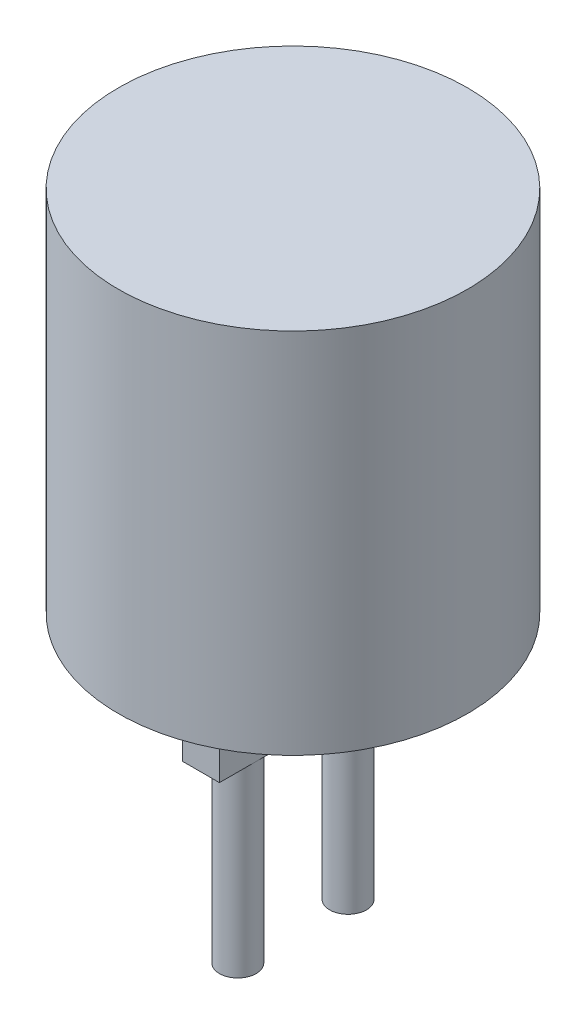
from build123d import *

# Parameters (mm, degrees)
SKETCH_1_W        = 9.5
SKETCH_1_H        = 20
SKETCH_2_R        = 1
EXTRUDE_457_DEPTH = 15
SKETCH_3_W        = 2
SKETCH_3_H        = 10
EXTRUDE_556_DEPTH = 5


with BuildPart() as part:
    # Эскиз1 → Revolve 326 (revolve)
    with BuildSketch(Plane.XY, mode=Mode.PRIVATE) as revolve_326_sk:
        with Locations((4.75, 10)):
            Rectangle(SKETCH_1_W, SKETCH_1_H)
    revolve(revolve_326_sk.sketch.rotate(Axis((0, 0, 0), (0, 1, 0)), 90), axis=Axis((0, 0, 0), (0, 1, 0)))

    # Эскиз2 → Extrude 457 (add)
    with BuildSketch(Plane(origin=(0, 0, 0), x_dir=(1, 0, 0), z_dir=(0, 1, 0))):
        with Locations(Location((0, -3, 0), (0, 0, 270))):
            Circle(SKETCH_2_R)
        with Locations(Location((0, 3, 0), (0, 0, 270))):
            Circle(SKETCH_2_R)
    extrude(amount=-EXTRUDE_457_DEPTH)

    # Эскиз3 → Extrude 556 (add)
    with BuildSketch(Plane(origin=(0, 0, 0), x_dir=(1, 0, 0), z_dir=(0, 1, 0))):
        Rectangle(SKETCH_3_W, SKETCH_3_H)
    extrude(amount=-EXTRUDE_556_DEPTH)


solid = part.part
